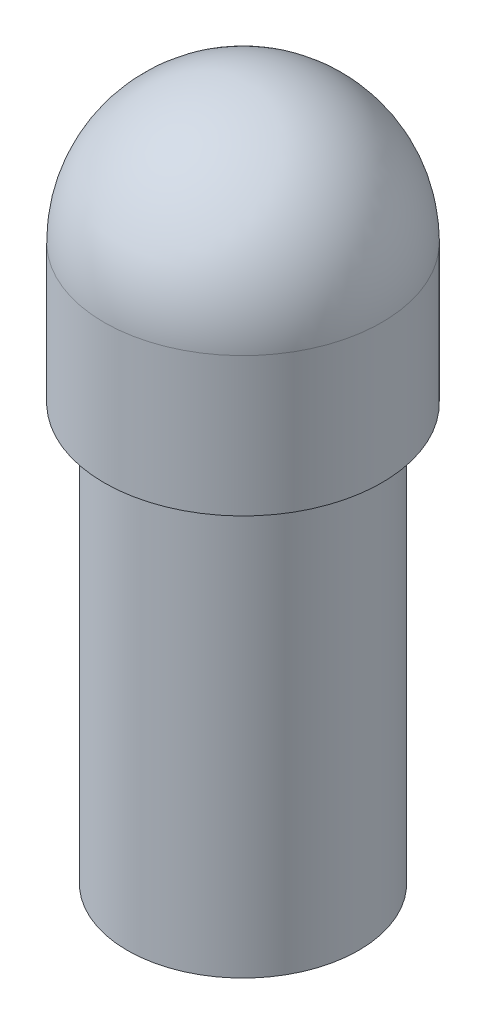
from build123d import *

# Parameters (mm, degrees)
SKETCH1_R           = 5
BOSS_EXTRUDE1_DEPTH = 18
SKETCH2_R           = 6
BOSS_EXTRUDE2_DEPTH = 12
FILLET2_R           = 6


with BuildPart() as part:
    # Sketch1 → Boss-Extrude1 (new body)
    with BuildSketch(Plane(origin=(0, 0, 0), x_dir=(1, 0, 0), z_dir=(0, 1, 0))):
        with Locations(Location((0, 0, 0), (0, 0, 270))):
            Circle(SKETCH1_R)
    extrude(amount=BOSS_EXTRUDE1_DEPTH)

    # Sketch2 → Boss-Extrude2 (add)
    with BuildSketch(Plane(origin=(0, 18, 0), x_dir=(1, 0, 0), z_dir=(0, 1, 0))):
        with Locations(Location((0, 0, 0), (0, 0, 270))):
            Circle(SKETCH2_R)
    extrude(amount=BOSS_EXTRUDE2_DEPTH)

    # Fillet2
    fillet2_edges = [part.edges().sort_by_distance(p)[0] for p in [
        (0, 30, -6),
    ]]
    fillet(fillet2_edges, radius=FILLET2_R)


solid = part.part
